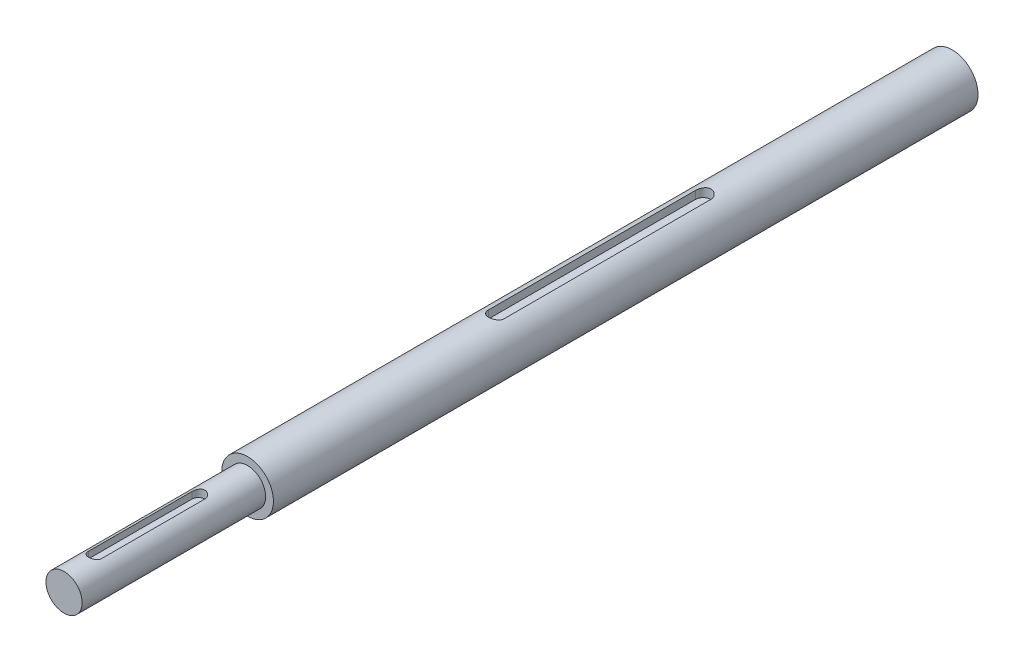
from build123d import *

# Parameters (mm, degrees)
IZIM1_R                     = 10
Y_KSEKLIK_EKSTR_ZYON1_DEPTH = 136.3
IZIM2_R                     = 7
Y_KSEKLIK_EKSTR_ZYON2_DEPTH = 71
KES_EKSTR_ZYON1_DEPTH       = 3
KES_EKSTR_ZYON2_DEPTH       = 3.5


with BuildPart() as part:
    # Çizim1 → Yükseklik-Ekstrüzyon1 (new, symmetric)
    with BuildSketch(Plane.XY):
        Circle(IZIM1_R)
    extrude(amount=Y_KSEKLIK_EKSTR_ZYON1_DEPTH, both=True)

    # Çizim2 → Yükseklik-Ekstrüzyon2 (add)
    with BuildSketch(Plane.XY.offset(136.3)):
        Circle(IZIM2_R)
    extrude(amount=Y_KSEKLIK_EKSTR_ZYON2_DEPTH)

    # Çizim3 → Kes-Ekstrüzyon1 (cut)
    with BuildSketch(Plane(origin=(0, 7, 0), x_dir=(1, 0, 0), z_dir=(0, 1, 0))):
        with BuildLine():
            Line((2.5, -155.3), (2.5, -195.3))
            ThreePointArc((2.5, -195.3), (0, -197.8), (-2.5, -195.3))
            Line((-2.5, -195.3), (-2.5, -155.3))
            ThreePointArc((-2.5, -155.3), (0, -152.8), (2.5, -155.3))
        make_face()
    extrude(amount=-KES_EKSTR_ZYON1_DEPTH, mode=Mode.SUBTRACT)

    # Çizim4 → Kes-Ekstrüzyon2 (cut)
    with BuildSketch(Plane(origin=(0, 10, 0), x_dir=(1, 0, 0), z_dir=(0, 1, 0))):
        with BuildLine():
            Line((-3, -40), (-3, 40))
            ThreePointArc((-3, 40), (0, 43), (3, 40))
            Line((3, 40), (3, -40))
            ThreePointArc((3, -40), (0, -43), (-3, -40))
        make_face()
    extrude(amount=-KES_EKSTR_ZYON2_DEPTH, mode=Mode.SUBTRACT)


solid = part.part
